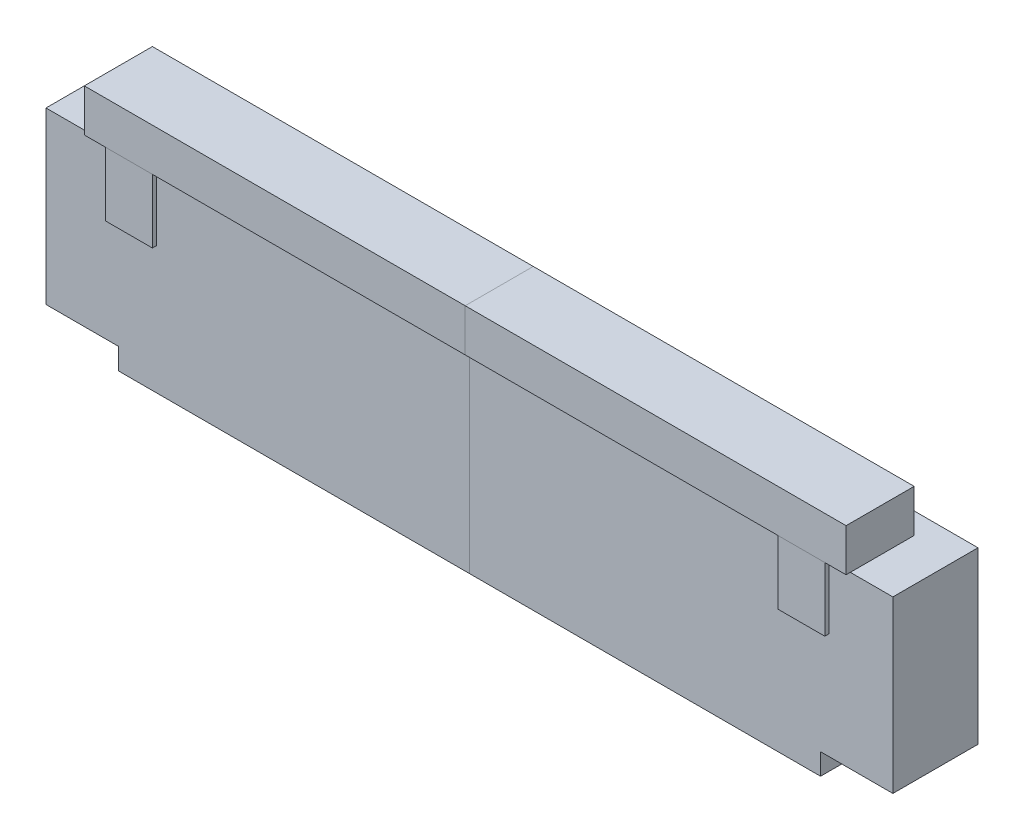
from build123d import *

# Parameters (mm, degrees)
SKETCH_1_W             = 9.95
SKETCH_1_H             = 4.5
EXTRUDE_1_DEPTH        = 2
SKETCH_3_W             = 1.7
SKETCH_3_H             = 1.4
CUT_EXTRUDE_1_DEPTH    = 0.5
SKETCH_4_W             = 1
SKETCH_4_H             = 0.6
CUT_EXTRUDE_2_DEPTH    = 0.5
SKETCH_2_W             = 8.95
SKETCH_2_H             = 1.6
EXTRUDE_2_DEPTH        = 1
SKETCH_5_W             = 1.1
SKETCH_5_H             = 1.6
EXTRUDE_3_DEPTH        = 1.5
SKETCH_7_W             = 0.2
SKETCH_7_H             = 0.15
EXTRUDE_4_DEPTH        = 0.7
PATTERN_LINEAR_1_COUNT = 29
PATTERN_LINEAR_1_PITCH = 0.5


with BuildPart() as part:
    # Эскиз1 → Бобышка-Вытянуть1 (new body)
    with BuildSketch(Plane.XY):
        with Locations((4.975, -2.25)):
            Rectangle(SKETCH_1_W, SKETCH_1_H)
    extrude(amount=EXTRUDE_1_DEPTH)

    # Эскиз3 → Вырез-Вытянуть1 (cut)
    with BuildSketch(Plane.XZ.offset(4.5)):
        with Locations((9.1, 1.3)):
            Rectangle(SKETCH_3_W, SKETCH_3_H)
    extrude(amount=-CUT_EXTRUDE_1_DEPTH, mode=Mode.SUBTRACT)

    # Эскиз4 → Вырез-Вытянуть2 (cut)
    with BuildSketch(Plane.XZ.offset(4.5)):
        with Locations((9.45, 0.3)):
            Rectangle(SKETCH_4_W, SKETCH_4_H)
    extrude(amount=-CUT_EXTRUDE_2_DEPTH, mode=Mode.SUBTRACT)


with BuildPart() as body_2:
    # Эскиз2 → Бобышка-Вытянуть2 (new body)
    with BuildSketch(Plane(origin=(0, 0, 0), x_dir=(1, 0, 0), z_dir=(0, 1, 0))):
        with Locations((4.475, -1.3)):
            Rectangle(SKETCH_2_W, SKETCH_2_H)
    extrude(amount=EXTRUDE_2_DEPTH)


with BuildPart() as body_3:
    # Эскиз5 → Бобышка-Вытянуть3 (new body)
    with BuildSketch(Plane.XZ):
        with Locations((7.9, 1.3)):
            Rectangle(SKETCH_5_W, SKETCH_5_H)
    extrude(amount=EXTRUDE_3_DEPTH)


with BuildPart() as body_4:
    # Зеркальное отражение1: mirrored copy
    add(body_2.part.mirror(Plane(origin=(0, -4.5, 2), x_dir=(0, 0, 1), z_dir=(1, 0, 0))))


with BuildPart() as body_5:
    # Mirror 1 2: mirrored copy
    add(part.part.mirror(Plane(origin=(0, -4.5, 2), x_dir=(0, 0, 1), z_dir=(1, 0, 0))))


with BuildPart() as body_6:
    # Mirror 1 3: mirrored copy
    add(body_3.part.mirror(Plane(origin=(0, -4.5, 2), x_dir=(0, 0, 1), z_dir=(1, 0, 0))))


with BuildPart() as body_7:
    # Эскиз7 → Бобышка-Вытянуть4 (new body)
    with BuildSketch(Plane.XZ.offset(4.5)):
        with Locations((7, 0.075)):
            Rectangle(SKETCH_7_W, SKETCH_7_H)
    extrude_4 = extrude(amount=EXTRUDE_4_DEPTH)


with BuildPart() as pattern_linear_1_1:
    # Линейный массив1: Бобышка-Вытянуть4 ×29
    with Locations(*[(-i * PATTERN_LINEAR_1_PITCH, 0, 0) for i in range(1, PATTERN_LINEAR_1_COUNT)]):
        add(extrude_4)


solid = Compound([part.part, body_2.part, body_3.part, body_4.part, body_5.part, body_6.part, body_7.part, pattern_linear_1_1.part])
